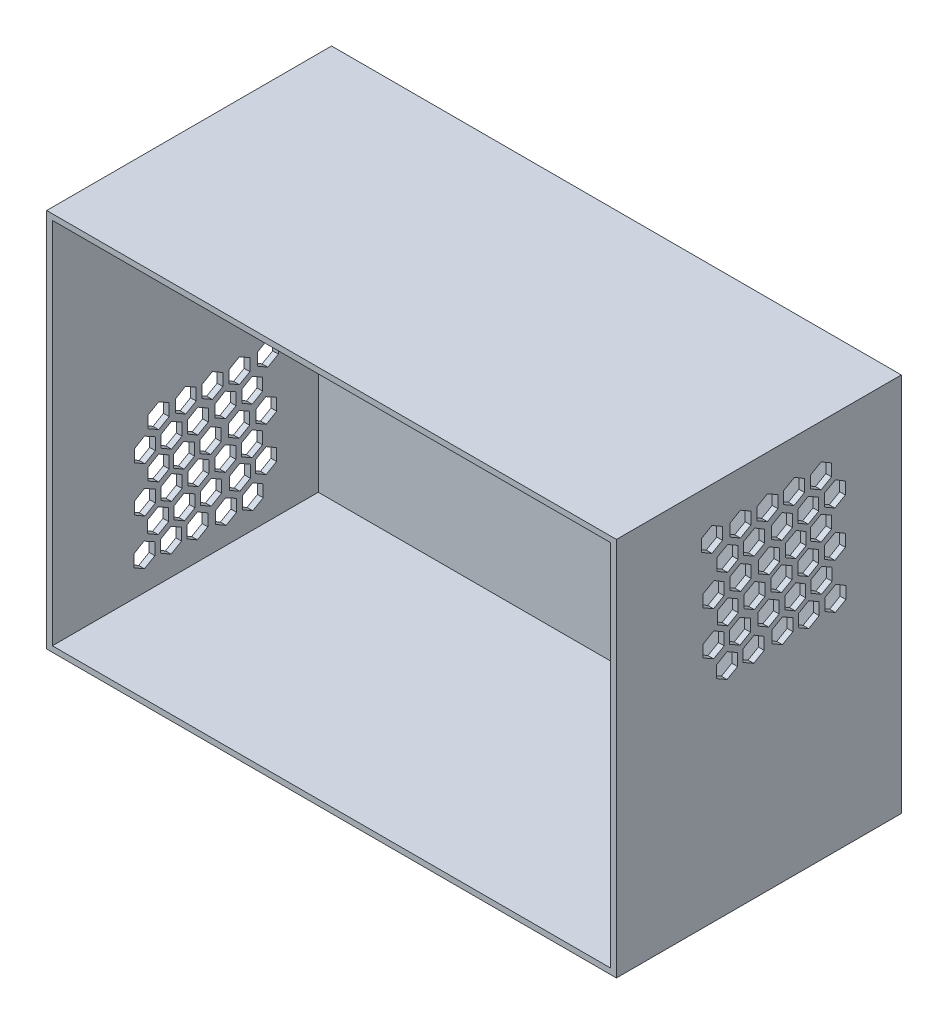
from build123d import *

# Parameters (mm, degrees)
ESQUISSE4_W             = 150
ESQUISSE4_H             = 100
BOSS_EXTRU_7_DEPTH      = 75
ESQUISSE9_W             = 147
ESQUISSE9_H             = 97
ENL_V_MAT_EXTRU_3_DEPTH = 70
ENL_V_MAT_EXTRU_5_DEPTH = 4
ENL_V_MAT_EXTRU_8_DEPTH = 4


with BuildPart() as part:
    # Esquisse4 → Boss.-Extru.7 (new body)
    with BuildSketch(Plane.XY):
        with Locations((-14.675875105, 0.514740538)):
            Rectangle(ESQUISSE4_W, ESQUISSE4_H)
    extrude(amount=BOSS_EXTRU_7_DEPTH)

    # Esquisse9 → Enlèv. mat.-Extru.3 (cut)
    with BuildSketch(Plane.XY.offset(75)):
        with Locations((-14.675875105, 0.514740538)):
            Rectangle(ESQUISSE9_W, ESQUISSE9_H)
    extrude(amount=-ENL_V_MAT_EXTRU_3_DEPTH, mode=Mode.SUBTRACT)

    # Esquisse10 → Enlèv. mat.-Extru.5 (cut)
    with BuildSketch(Plane(origin=(60.324124895, 0, 0), x_dir=(0, 0, -1), z_dir=(1, 0, 0))):
        Polygon((-38.549825855, 22.704782575), (-41.439233228, 21.11454283), (-41.439233228, 17.934063341), (-38.684857194, 16.343823597), (-35.93048116, 17.934063341), (-35.93048116, 21.11454283), align=None)
        Polygon((-45.693609262, 22.523658602), (-48.447985295, 20.933418857), (-48.447985295, 17.752939368), (-45.693609262, 16.162699624), (-42.939233228, 17.752939368), (-42.939233228, 20.933418857), align=None)
        Polygon((-42.312333355, 28.664487833), (-45.066709389, 27.074248088), (-45.066709389, 23.893768599), (-42.312333355, 22.303528855), (-39.557957321, 23.893768599), (-39.557957321, 27.074248088), align=None)
        Polygon((-27.6565108, 28.889563273), (-30.545918173, 27.299323528), (-30.545918173, 24.118844039), (-27.791542139, 22.528604295), (-25.037166105, 24.118844039), (-25.037166105, 27.299323528), align=None)
        Polygon((-34.800294206, 28.7084393), (-37.55467024, 27.118199555), (-37.55467024, 23.937720066), (-34.800294206, 22.347480322), (-32.045918173, 23.937720066), (-32.045918173, 27.118199555), align=None)
        Polygon((-31.4190183, 34.849268531), (-34.173394333, 33.259028786), (-34.173394333, 30.078549297), (-31.4190183, 28.488309552), (-28.664642266, 30.078549297), (-28.664642266, 33.259028786), align=None)
        Polygon((-27.783729979, 17.043529084), (-30.673137352, 15.45328934), (-30.673137352, 12.272809851), (-27.918761318, 10.682570106), (-25.164385285, 12.272809851), (-25.164385285, 15.45328934), align=None)
        Polygon((-34.927513386, 16.862405111), (-37.68188942, 15.272165367), (-37.68188942, 12.091685878), (-34.927513386, 10.501446133), (-32.173137352, 12.091685878), (-32.173137352, 15.272165367), align=None)
        Polygon((-31.546237479, 23.003234342), (-34.300613513, 21.412994598), (-34.300613513, 18.232515109), (-31.546237479, 16.642275364), (-28.791861445, 18.232515109), (-28.791861445, 21.412994598), align=None)
        Polygon((-38.724579422, 10.540700437), (-41.613986795, 8.950460693), (-41.613986795, 5.769981204), (-38.859610761, 4.179741459), (-36.105234727, 5.769981204), (-36.105234727, 8.950460693), align=None)
        Polygon((-45.868362828, 10.359576465), (-48.622738862, 8.76933672), (-48.622738862, 5.588857231), (-45.868362828, 3.998617486), (-43.113986795, 5.588857231), (-43.113986795, 8.76933672), align=None)
        Polygon((-42.487086922, 16.500405695), (-45.241462955, 14.910165951), (-45.241462955, 11.729686462), (-42.487086922, 10.139446717), (-39.732710888, 11.729686462), (-39.732710888, 14.910165951), align=None)
        Polygon((-31.29179912, 11.015330485), (-34.046175154, 9.425090741), (-34.046175154, 6.244611251), (-31.29179912, 4.654371507), (-28.537423086, 6.244611251), (-28.537423086, 9.425090741), align=None)
        Polygon((-17.224538076, 11.401933716), (-20.113945448, 9.811693972), (-20.113945448, 6.631214483), (-17.359569415, 5.040974738), (-14.605193381, 6.631214483), (-14.605193381, 9.811693972), align=None)
        Polygon((-24.368321482, 11.220809743), (-27.122697516, 9.630569999), (-27.122697516, 6.45009051), (-24.368321482, 4.859850765), (-21.613945448, 6.45009051), (-21.613945448, 9.630569999), align=None)
        Polygon((-20.987045575, 17.361638974), (-23.741421609, 15.77139923), (-23.741421609, 12.590919741), (-20.987045575, 11.000679996), (-18.232669542, 12.590919741), (-18.232669542, 15.77139923), align=None)
        Polygon((-17.351757255, 23.345886106), (-20.241164628, 21.755646362), (-20.241164628, 18.575166873), (-17.486788594, 16.984927128), (-14.73241256, 18.575166873), (-14.73241256, 21.755646362), align=None)
        Polygon((-24.495540662, 23.164762133), (-27.249916696, 21.574522389), (-27.249916696, 18.3940429), (-24.495540662, 16.803803155), (-21.741164628, 18.3940429), (-21.741164628, 21.574522389), align=None)
        Polygon((-21.114264755, 29.305591364), (-23.868640789, 27.71535162), (-23.868640789, 24.53487213), (-21.114264755, 22.944632386), (-18.359888721, 24.53487213), (-18.359888721, 27.71535162), align=None)
        Polygon((-38.597360242, 34.908180957), (-41.486767615, 33.317941213), (-41.486767615, 30.137461724), (-38.732391581, 28.547221979), (-35.978015548, 30.137461724), (-35.978015548, 33.317941213), align=None)
        Polygon((-45.741143649, 34.727056985), (-48.495519683, 33.13681724), (-48.495519683, 29.956337751), (-45.741143649, 28.366098006), (-42.986767615, 29.956337751), (-42.986767615, 33.13681724), align=None)
        Polygon((-42.359867742, 40.867886215), (-45.114243776, 39.277646471), (-45.114243776, 36.097166982), (-42.359867742, 34.506927237), (-39.605491708, 36.097166982), (-39.605491708, 39.277646471), align=None)
        Polygon((-17.351757255, 35.275188007), (-20.241164628, 33.684948263), (-20.241164628, 30.504468773), (-17.486788594, 28.914229029), (-14.73241256, 30.504468773), (-14.73241256, 33.684948263), align=None)
        Polygon((-24.495540662, 35.094064034), (-27.249916696, 33.50382429), (-27.249916696, 30.323344801), (-24.495540662, 28.733105056), (-21.741164628, 30.323344801), (-21.741164628, 33.50382429), align=None)
        Polygon((-21.114264755, 41.234893265), (-23.868640789, 39.64465352), (-23.868640789, 36.464174031), (-21.114264755, 34.873934287), (-18.359888721, 36.464174031), (-18.359888721, 39.64465352), align=None)
        Polygon((-49.304126394, 28.294015245), (-52.193533767, 26.703775501), (-52.193533767, 23.523296012), (-49.439157733, 21.933056267), (-46.6847817, 23.523296012), (-46.6847817, 26.703775501), align=None)
        Polygon((-49.852867532, 41.119780191), (-52.607243566, 39.529540446), (-52.607243566, 36.349060957), (-49.852867532, 34.758821213), (-47.098491499, 36.349060957), (-47.098491499, 39.529540446), align=None)
        Polygon((-49.402721523, 16.850136739), (-52.157097556, 15.259896994), (-52.157097556, 12.079417505), (-49.402721523, 10.489177761), (-46.648345489, 12.079417505), (-46.648345489, 15.259896994), align=None)
        Polygon((-28.103836414, 41.227152625), (-30.993243787, 39.63691288), (-30.993243787, 36.456433391), (-28.238867753, 34.866193647), (-25.484491719, 36.456433391), (-25.484491719, 39.63691288), align=None)
        Polygon((-35.24761982, 41.046028652), (-38.001995854, 39.455788907), (-38.001995854, 36.275309418), (-35.24761982, 34.685069674), (-32.493243787, 36.275309418), (-32.493243787, 39.455788907), align=None)
    extrude(amount=-ENL_V_MAT_EXTRU_5_DEPTH, mode=Mode.SUBTRACT)

    # Esquisse13 → Enlèv. mat.-Extru.8 (cut)
    with BuildSketch(Plane.ZY.offset(89.675875105)):
        Polygon((29.577800547, -24.870621379), (26.688393174, -26.460861124), (26.688393174, -29.641340613), (29.442769208, -31.231580357), (32.197145242, -29.641340613), (32.197145242, -26.460861124), align=None)
        Polygon((22.43401714, -25.051745352), (19.679641107, -26.641985096), (19.679641107, -29.822464585), (22.43401714, -31.41270433), (25.188393174, -29.822464585), (25.188393174, -26.641985096), align=None)
        Polygon((25.815293047, -18.910916121), (23.060917013, -20.501155866), (23.060917013, -23.681635355), (25.815293047, -25.271875099), (28.569669081, -23.681635355), (28.569669081, -20.501155866), align=None)
        Polygon((40.471115602, -18.685840681), (37.581708229, -20.276080426), (37.581708229, -23.456559915), (40.336084263, -25.046799659), (43.090460297, -23.456559915), (43.090460297, -20.276080426), align=None)
        Polygon((33.327332196, -18.866964654), (30.572956162, -20.457204398), (30.572956162, -23.637683888), (33.327332196, -25.227923632), (36.081708229, -23.637683888), (36.081708229, -20.457204398), align=None)
        Polygon((36.708608102, -12.726135423), (33.954232069, -14.316375168), (33.954232069, -17.496854657), (36.708608102, -19.087094401), (39.462984136, -17.496854657), (39.462984136, -14.316375168), align=None)
        Polygon((40.343896423, -30.53187487), (37.45448905, -32.122114614), (37.45448905, -35.302594103), (40.208865084, -36.892833848), (42.963241117, -35.302594103), (42.963241117, -32.122114614), align=None)
        Polygon((33.200113016, -30.712998842), (30.445736982, -32.303238587), (30.445736982, -35.483718076), (33.200113016, -37.073957821), (35.95448905, -35.483718076), (35.95448905, -32.303238587), align=None)
        Polygon((36.581388923, -24.572169612), (33.827012889, -26.162409356), (33.827012889, -29.342888845), (36.581388923, -30.93312859), (39.335764957, -29.342888845), (39.335764957, -26.162409356), align=None)
        Polygon((29.40304698, -37.034703516), (26.513639607, -38.624943261), (26.513639607, -41.80542275), (29.268015641, -43.395662495), (32.022391675, -41.80542275), (32.022391675, -38.624943261), align=None)
        Polygon((22.259263574, -37.215827489), (19.50488754, -38.806067234), (19.50488754, -41.986546723), (22.259263574, -43.576786467), (25.013639607, -41.986546723), (25.013639607, -38.806067234), align=None)
        Polygon((25.64053948, -31.074998258), (22.886163447, -32.665238003), (22.886163447, -35.845717492), (25.64053948, -37.435957237), (28.394915514, -35.845717492), (28.394915514, -32.665238003), align=None)
        Polygon((36.835827282, -36.560073469), (34.081451248, -38.150313213), (34.081451248, -41.330792702), (36.835827282, -42.921032447), (39.590203316, -41.330792702), (39.590203316, -38.150313213), align=None)
        Polygon((50.903088326, -36.173470238), (48.013680954, -37.763709982), (48.013680954, -40.944189471), (50.768056987, -42.534429216), (53.522433021, -40.944189471), (53.522433021, -37.763709982), align=None)
        Polygon((43.75930492, -36.35459421), (41.004928886, -37.944833955), (41.004928886, -41.125313444), (43.75930492, -42.715553189), (46.513680954, -41.125313444), (46.513680954, -37.944833955), align=None)
        Polygon((47.140580827, -30.21376498), (44.386204793, -31.804004724), (44.386204793, -34.984484213), (47.140580827, -36.574723958), (49.89495686, -34.984484213), (49.89495686, -31.804004724), align=None)
        Polygon((50.775869147, -24.229517848), (47.886461774, -25.819757592), (47.886461774, -29.000237081), (50.640837808, -30.590476826), (53.395213842, -29.000237081), (53.395213842, -25.819757592), align=None)
        Polygon((43.63208574, -24.41064182), (40.877709707, -26.000881565), (40.877709707, -29.181361054), (43.63208574, -30.771600799), (46.386461774, -29.181361054), (46.386461774, -26.000881565), align=None)
        Polygon((47.013361647, -18.26981259), (44.258985613, -19.860052334), (44.258985613, -23.040531823), (47.013361647, -24.630771568), (49.767737681, -23.040531823), (49.767737681, -19.860052334), align=None)
        Polygon((29.53026616, -12.667222996), (26.640858787, -14.257462741), (26.640858787, -17.43794223), (29.395234821, -19.028181975), (32.149610854, -17.43794223), (32.149610854, -14.257462741), align=None)
        Polygon((22.386482753, -12.848346969), (19.632106719, -14.438586714), (19.632106719, -17.619066203), (22.386482753, -19.209305947), (25.140858787, -17.619066203), (25.140858787, -14.438586714), align=None)
        Polygon((25.76775866, -6.707517738), (23.013382626, -8.297757483), (23.013382626, -11.478236972), (25.76775866, -13.068476717), (28.522134694, -11.478236972), (28.522134694, -8.297757483), align=None)
        Polygon((50.775869147, -12.300215947), (47.886461774, -13.890455691), (47.886461774, -17.07093518), (50.640837808, -18.661174925), (53.395213842, -17.07093518), (53.395213842, -13.890455691), align=None)
        Polygon((43.63208574, -12.48133992), (40.877709707, -14.071579664), (40.877709707, -17.252059153), (43.63208574, -18.842298898), (46.386461774, -17.252059153), (46.386461774, -14.071579664), align=None)
        Polygon((47.013361647, -6.340510689), (44.258985613, -7.930750433), (44.258985613, -11.111229922), (47.013361647, -12.701469667), (49.767737681, -11.111229922), (49.767737681, -7.930750433), align=None)
        Polygon((18.823500008, -19.281388709), (15.934092635, -20.871628453), (15.934092635, -24.052107942), (18.688468669, -25.642347687), (21.442844702, -24.052107942), (21.442844702, -20.871628453), align=None)
        Polygon((18.27475887, -6.455623763), (15.520382836, -8.045863507), (15.520382836, -11.226342997), (18.27475887, -12.816582741), (21.029134903, -11.226342997), (21.029134903, -8.045863507), align=None)
        Polygon((18.724904879, -30.725267215), (15.970528846, -32.31550696), (15.970528846, -35.495986449), (18.724904879, -37.086226193), (21.479280913, -35.495986449), (21.479280913, -32.31550696), align=None)
        Polygon((40.023789988, -6.348251329), (37.134382615, -7.938491074), (37.134382615, -11.118970563), (39.888758649, -12.709210307), (42.643134683, -11.118970563), (42.643134683, -7.938491074), align=None)
        Polygon((32.880006582, -6.529375302), (30.125630548, -8.119615046), (30.125630548, -11.300094535), (32.880006582, -12.89033428), (35.634382615, -11.300094535), (35.634382615, -8.119615046), align=None)
    extrude(amount=-ENL_V_MAT_EXTRU_8_DEPTH, mode=Mode.SUBTRACT)


solid = part.part
